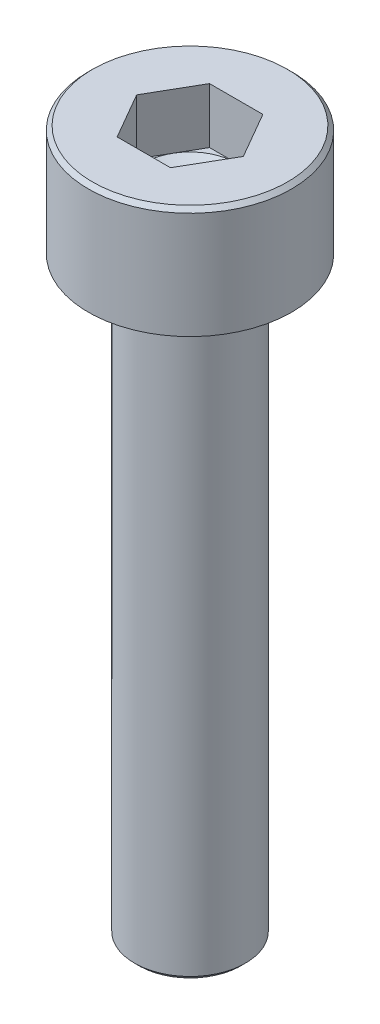
from build123d import *

# Parameters (mm, degrees)
CHAMFER_1_SIZE      = 0.12
CHAMFER_2_SIZE      = 0.11
CUT_EXTRUDE_1_DEPTH = 1.5
CUT_EXTRUDE_2_REACH = 21.394
SKETCH_4_R          = 0.6


with BuildPart() as part:
    # 草图2 → 旋转1 (revolve)
    with BuildSketch(Plane.XY):
        Polygon((-1.25, 0), (-1.25, -1.5), (0, -2.221687836), (0, -19), (-1.5, -19), (-1.5, -3), (-2.75, -3), (-2.75, 0), align=None)
    revolve(axis=Axis((0, -2.221687836, 0), (0, -1, 0)))

    # 倒角1
    chamfer_1_edges = [part.edges().sort_by_distance(p)[0] for p in [
        (1.5, -19, 0),
    ]]
    chamfer(chamfer_1_edges, length=CHAMFER_1_SIZE)

    # 倒角2
    chamfer_2_edges = [part.edges().sort_by_distance(p)[0] for p in [
        (2.75, 0, 0),
    ]]
    chamfer(chamfer_2_edges, length=CHAMFER_2_SIZE)

    # 草图3 → 切除-拉伸1 (cut)
    with BuildSketch(Plane(origin=(0, 0, 0), x_dir=(-1, 0, 0), z_dir=(0, 1, 0))):
        Polygon((-0.721687836, 1.25), (-1.443375673, 0), (-0.721687836, -1.25), (0.721687836, -1.25), (1.443375673, 0), (0.721687836, 1.25), align=None)
    extrude(amount=-CUT_EXTRUDE_1_DEPTH, mode=Mode.SUBTRACT)

    # 切除-拉伸2: up to this cone (the profile starts outside it)
    cut_extrude_2_end = Plane(origin=(0, -19, 0), z_dir=(0, 1, 0)).offset(16.778313164) * Cone(1.732e-06, 8.860631248, 5.115686836, align=(Align.CENTER, Align.CENTER, Align.MIN), mode=Mode.PRIVATE)
    # 草图4 → 切除-拉伸2 (cut, up to the surface)
    with BuildSketch(Plane.XZ.offset(19), mode=Mode.PRIVATE) as cut_extrude_2_sk1:
        Circle(SKETCH_4_R)
    cut_extrude_2_tool1 = extrude(cut_extrude_2_sk1.sketch, amount=-CUT_EXTRUDE_2_REACH, mode=Mode.PRIVATE) - cut_extrude_2_end
    add(cut_extrude_2_tool1.solids().sort_by_distance((0, -19, 0))[0], mode=Mode.SUBTRACT)


solid = part.part
